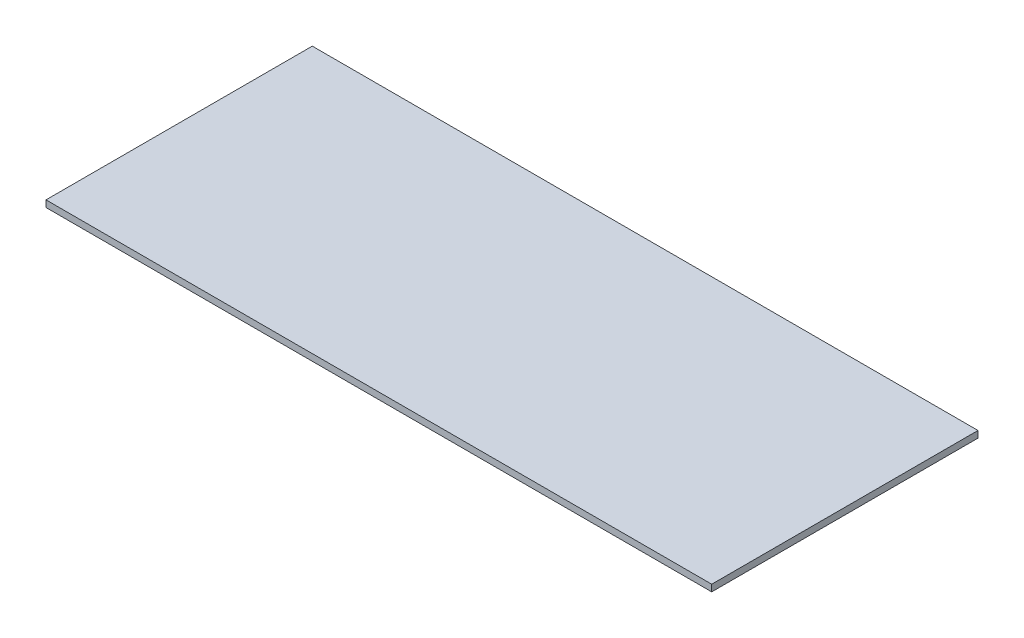
from build123d import *

# Parameters (mm, degrees)
SKETCH1_W           = 500
SKETCH1_H           = 200
BOSS_EXTRUDE1_DEPTH = 5


with BuildPart() as part:
    # Sketch1 → Boss-Extrude1 (new body)
    with BuildSketch(Plane(origin=(0, 0, 0), x_dir=(1, 0, 0), z_dir=(0, 1, 0))):
        Rectangle(SKETCH1_W, SKETCH1_H)
    extrude(amount=BOSS_EXTRUDE1_DEPTH)


solid = part.part
